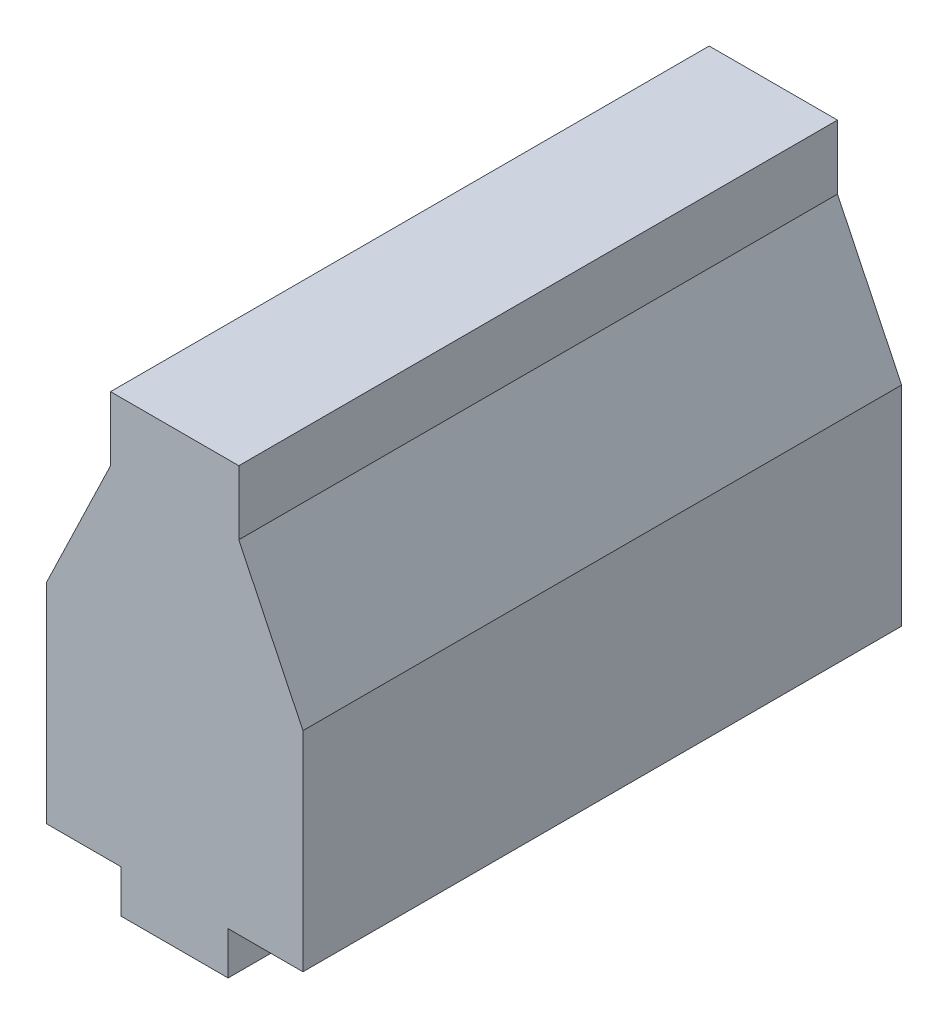
from build123d import *

# Parameters (mm, degrees)
BOSS_EXTRUDE1_DEPTH = 28


with BuildPart() as part:
    # Sketch1 → Boss-Extrude1 (new body)
    with BuildSketch(Plane.XY):
        Polygon((-3, 8.269565217), (3, 8.269565217), (3, 5.269565217), (6, -0.960434783), (6, -10.730434783), (2.5, -10.730434783), (2.5, -12.730434783), (-2.5, -12.730434783), (-2.5, -10.730434783), (-6, -10.730434783), (-6, -0.965217391), (-3, 5.269565217), align=None)
    extrude(amount=BOSS_EXTRUDE1_DEPTH)


solid = part.part
